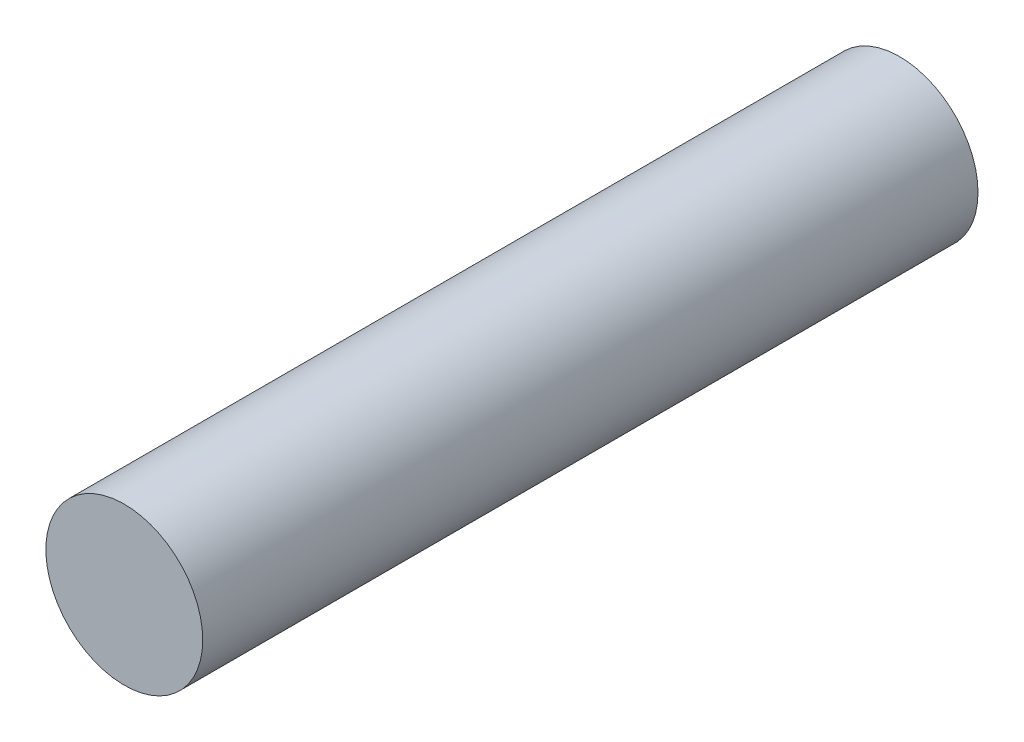
from build123d import *

# Parameters (mm, degrees)
SKETCH1_R           = 0.85
BOSS_EXTRUDE1_DEPTH = 8.4


with BuildPart() as part:
    # Sketch1 → Boss-Extrude1 (new body)
    with BuildSketch(Plane.XY):
        Circle(SKETCH1_R)
    extrude(amount=BOSS_EXTRUDE1_DEPTH)


solid = part.part
